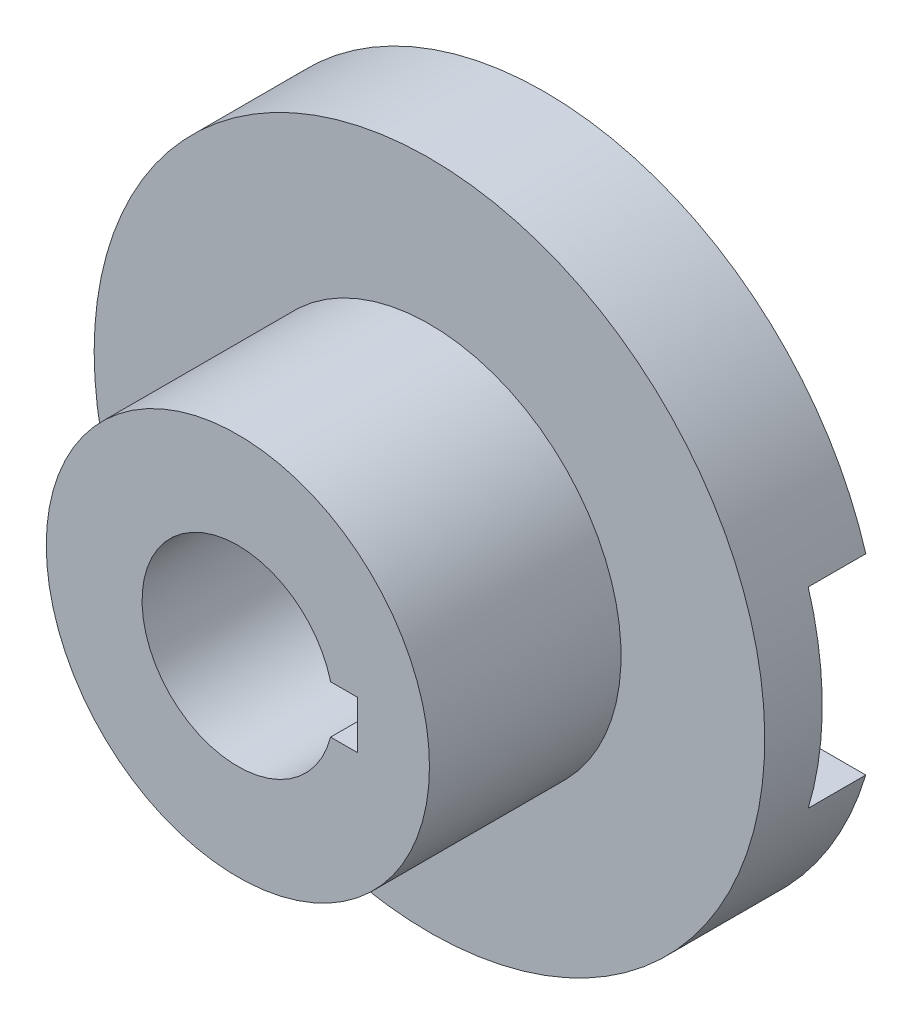
from build123d import *
from build123d.topology import SkipClean

# Parameters (mm, degrees)
SKETCH1_R           = 10
SKETCH1_R_2         = 5
BOSS_EXTRUDE1_DEPTH = 5
BOSS_EXTRUDE2_START = 6
SKETCH3_R           = 17.5
SKETCH3_R_2         = 5
BOSS_EXTRUDE2_DEPTH = 6
CUT_EXTRUDE1_DEPTH  = 3
SKETCH5_W           = 2.5
SKETCH5_H           = 2.5
CUT_EXTRUDE2_DEPTH  = 10


with BuildPart() as part:
    # Sketch1 → Boss-Extrude1 (new, symmetric)
    with BuildSketch(Plane.XY):
        Circle(SKETCH1_R)
        Circle(SKETCH1_R_2, mode=Mode.SUBTRACT)
    extrude(amount=BOSS_EXTRUDE1_DEPTH, both=True)

    # Sketch3 → Boss-Extrude2 (add)
    with SkipClean():  # the faces are left unmerged after this step: merging them gives an invalid solid
        with BuildSketch(Plane(origin=(0, 0, -5), x_dir=(-1, 0, 0), z_dir=(0, 0, -1)).offset(BOSS_EXTRUDE2_START)):
            Circle(SKETCH3_R)
            Circle(SKETCH3_R_2, mode=Mode.SUBTRACT)
        extrude(amount=-BOSS_EXTRUDE2_DEPTH)

    # Sketch4 → Cut-Extrude1 (cut)
    with SkipClean():  # the faces are left unmerged after this step: merging them gives an invalid solid
        with BuildSketch(Plane(origin=(0, 0, -11), x_dir=(-1, 0, 0), z_dir=(0, 0, -1))):
            with BuildLine():
                Line((-16.770509831, -5), (16.770509831, -5))
                ThreePointArc((16.770509831, -5), (17.5, 0), (16.770509831, 5))
                Line((16.770509831, 5), (-16.770509831, 5))
                ThreePointArc((-16.770509831, 5), (-17.5, 0), (-16.770509831, -5))
            make_face()
        extrude(amount=-CUT_EXTRUDE1_DEPTH, mode=Mode.SUBTRACT)

    # Sketch5 → Cut-Extrude2 (cut)
    with SkipClean():  # the faces are left unmerged after this step: merging them gives an invalid solid
        with BuildSketch(Plane.XY.offset(5)):
            with Locations((5, 0)):
                Rectangle(SKETCH5_W, SKETCH5_H)
        extrude(amount=-CUT_EXTRUDE2_DEPTH, mode=Mode.SUBTRACT)


solid = part.part
